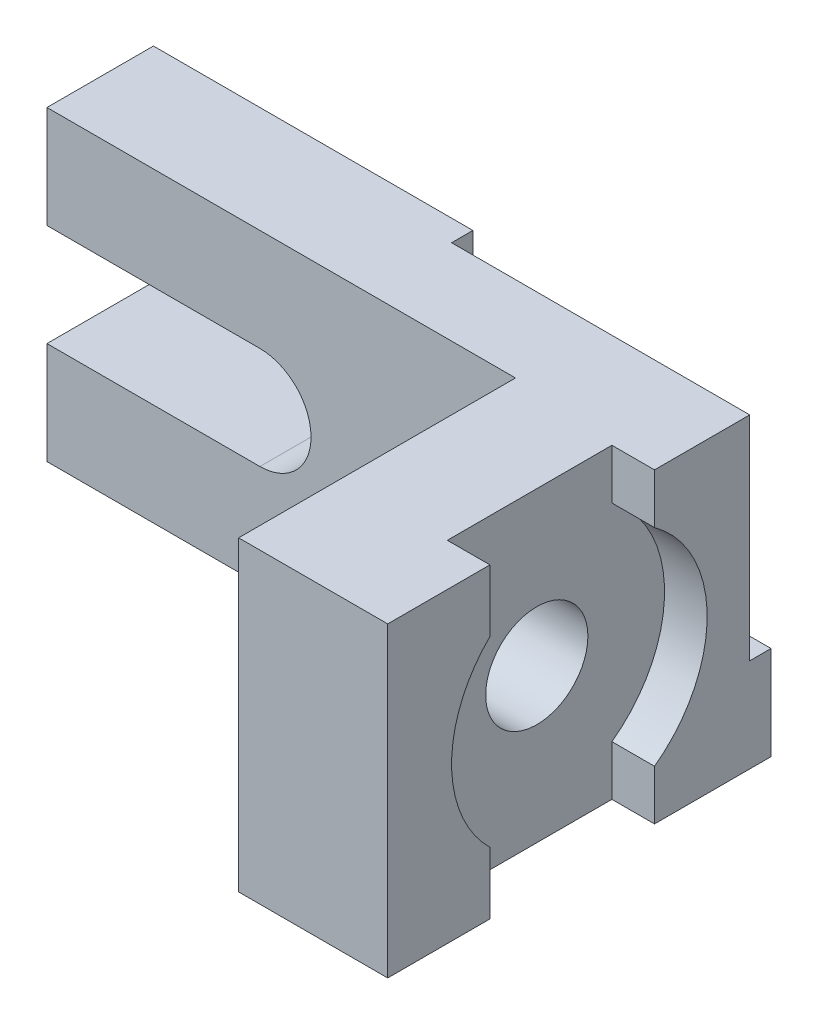
from build123d import *

# Parameters (mm, degrees)
BOSS_EXTRUDE1_DEPTH     = 36
CUT_EXTRUDE1_DEPTH      = 175.416168975
CUT_EXTRUDE1_DEPTH_BACK = 10
SKETCH2_R               = 30
SKETCH3_W               = 72
SKETCH3_H               = 38.639129372
CUT_EXTRUDE2_DEPTH      = 10
SKETCH4_R               = 12
CUT_EXTRUDE3_DEPTH      = 167.195667814
SKETCH5_W               = 50
SKETCH5_H               = 5
CUT_EXTRUDE4_DEPTH      = 70
CUT_EXTRUDE5_DEPTH      = 70


with BuildPart() as part:
    # Sketch1 → Boss-Extrude1 (new, symmetric)
    with BuildSketch(Plane(origin=(0, 0, 0), x_dir=(-1, 0, 0), z_dir=(0, 1, 0))):
        Polygon((0, 0), (145, 0), (145, 25), (35, 25), (35, 90), (0, 90), align=None)
    extrude(amount=BOSS_EXTRUDE1_DEPTH, both=True)

    # Sketch2 → Cut-Extrude1 (cut, two sides: drawn at the far end of the back side and taken through both)
    with BuildSketch(Plane.YZ.offset(-CUT_EXTRUDE1_DEPTH_BACK)):
        with Locations(Location((0, 45, 0), (0, 0, 90))):
            Circle(SKETCH2_R)
    extrude(amount=CUT_EXTRUDE1_DEPTH + CUT_EXTRUDE1_DEPTH_BACK, mode=Mode.SUBTRACT)

    # Sketch3 → Cut-Extrude2 (cut)
    with BuildSketch(Plane.YZ):
        with Locations((0, 46.680435314)):
            Rectangle(SKETCH3_W, SKETCH3_H)
    extrude(amount=-CUT_EXTRUDE2_DEPTH, mode=Mode.SUBTRACT)

    # Sketch4 → Cut-Extrude3 (cut, through all)
    with BuildSketch(Plane.YZ.offset(-10)):
        with Locations(Location((0, 45, 0), (0, 0, 270))):
            Circle(SKETCH4_R)
    extrude(amount=-CUT_EXTRUDE3_DEPTH, mode=Mode.SUBTRACT)

    # Sketch5 → Cut-Extrude4 (cut)
    with BuildSketch(Plane.YZ):
        with Locations((11, 2.5)):
            Rectangle(SKETCH5_W, SKETCH5_H)
    extrude(amount=-CUT_EXTRUDE4_DEPTH, mode=Mode.SUBTRACT)

    # Sketch6 → Cut-Extrude5 (cut)
    with BuildSketch(Plane.XY.offset(25)):
        with BuildLine():
            Line((-95, 12), (-145, 12))
            Line((-145, 12), (-145, -12))
            Line((-145, -12), (-95, -12))
            ThreePointArc((-95, -12), (-83, 0), (-95, 12))
        make_face()
    extrude(amount=-CUT_EXTRUDE5_DEPTH, mode=Mode.SUBTRACT)


solid = part.part
